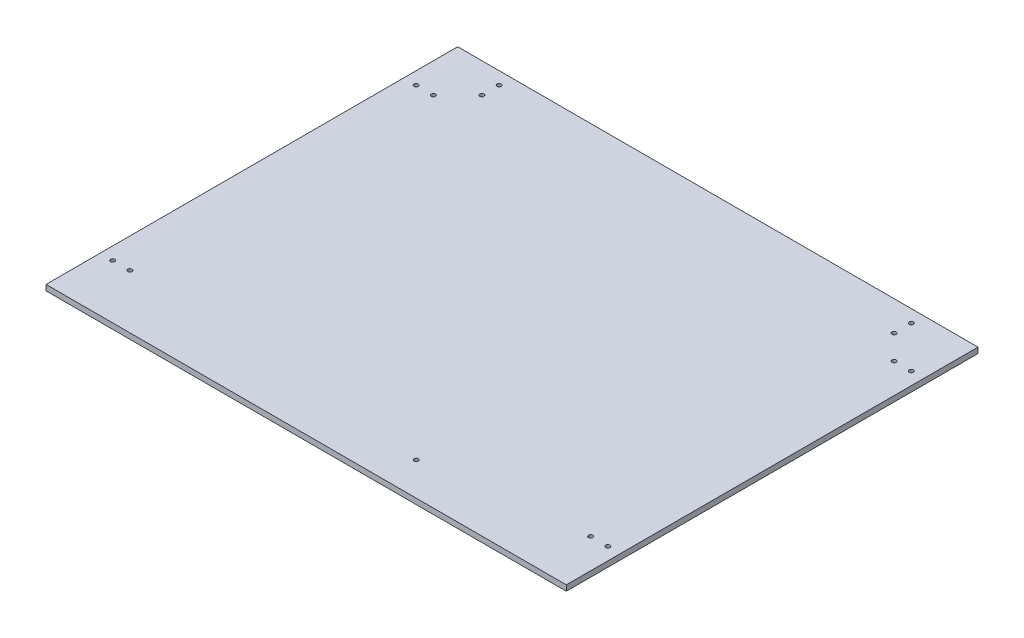
from build123d import *

# Parameters (mm, degrees)
SCHIZZO1_W                   = 558
SCHIZZO1_H                   = 441.5
ESTRUSIONE_ESTRUSIONE1_DEPTH = 6
SCHIZZO2_R                   = 2.25
TAGLIO_ESTRUSIONE1_DEPTH     = 10


with BuildPart() as part:
    # Schizzo1 → Estrusione-Estrusione1 (new body)
    with BuildSketch(Plane(origin=(0, 0, 0), x_dir=(1, 0, 0), z_dir=(0, 1, 0))):
        Rectangle(SCHIZZO1_W, SCHIZZO1_H)
    extrude(amount=ESTRUSIONE_ESTRUSIONE1_DEPTH)

    # Schizzo2 → Taglio-Estrusione1 (cut)
    with BuildSketch(Plane(origin=(0, 0, 0), x_dir=(-1, 0, 0), z_dir=(0, -1, 0))):
        with Locations(Location((-221, 207.25, 0), (0, 0, 90))):
            Circle(SCHIZZO2_R)
        with Locations(Location((-221, 188.75, 0), (0, 0, 90))):
            Circle(SCHIZZO2_R)
        with Locations(Location((-247, 162.75, 0), (0, 0, 90))):
            Circle(SCHIZZO2_R)
        with Locations(Location((-265.5, 162.75, 0), (0, 0, 90))):
            Circle(SCHIZZO2_R)
        with Locations(Location((221, 207.25, 0), (0, 0, 90))):
            Circle(SCHIZZO2_R)
        with Locations(Location((221, 188.75, 0), (0, 0, 90))):
            Circle(SCHIZZO2_R)
        with Locations(Location((247, 162.75, 0), (0, 0, 90))):
            Circle(SCHIZZO2_R)
        with Locations(Location((265.5, 162.75, 0), (0, 0, 90))):
            Circle(SCHIZZO2_R)
        with Locations(Location((265.5, -162.75, 0), (0, 0, 90))):
            Circle(SCHIZZO2_R)
        with Locations(Location((247, -162.75, 0), (0, 0, 90))):
            Circle(SCHIZZO2_R)
        with Locations(Location((-265.5, -162.75, 0), (0, 0, 90))):
            Circle(SCHIZZO2_R)
        with Locations(Location((-247, -162.75, 0), (0, 0, 90))):
            Circle(SCHIZZO2_R)
        with Locations(Location((-82.5, -185.25, 0), (0, 0, 90))):
            Circle(SCHIZZO2_R)
    extrude(amount=-TAGLIO_ESTRUSIONE1_DEPTH, mode=Mode.SUBTRACT)


solid = part.part
